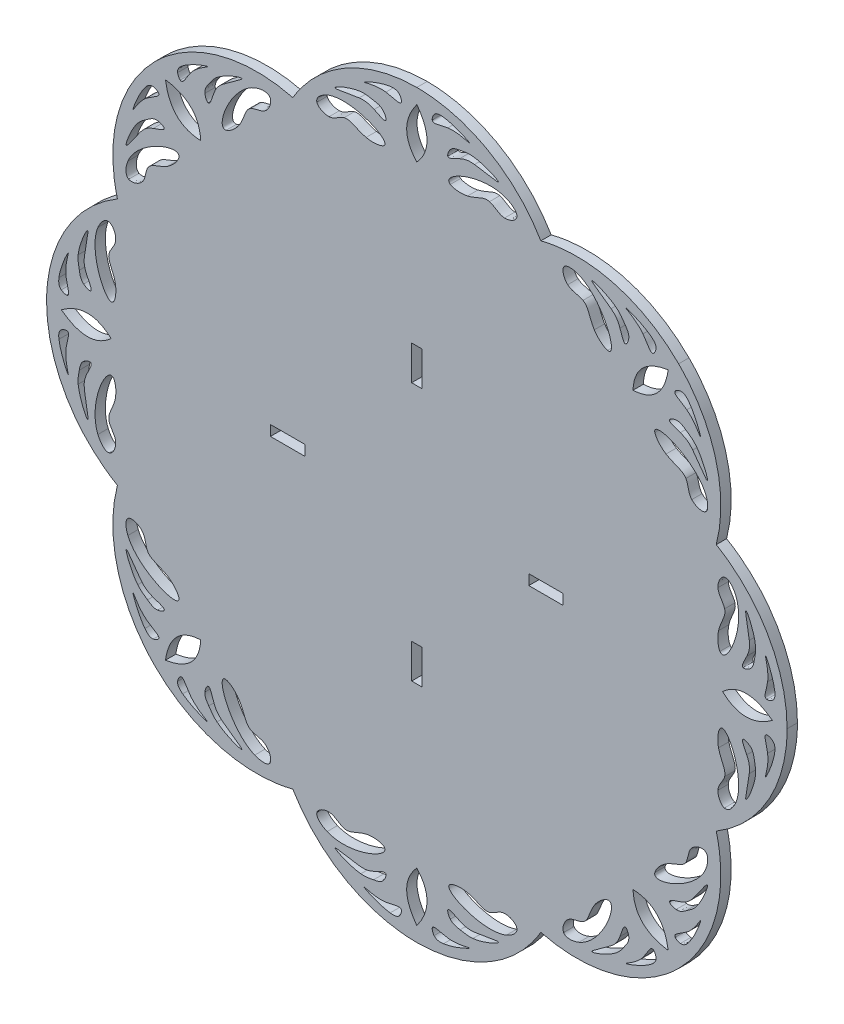
from build123d import *

# Parameters (mm, degrees)
MODEL_W                  = 2
MODEL_H                  = 6.6667
MODEL_W_2                = 6.6666
MODEL_H_2                = 2
RESSALTO_EXTRUS_O1_DEPTH = 2


with BuildPart() as part:
    # Model → Ressalto-extrusão1 (new body)
    with BuildSketch(Plane.XY):
        with BuildLine():
            add(Edge.make_bspline(
                [(57.9546, 38.6366), (66.4517, 43.6479), (71.6666, 52.7775), (71.6666, 62.6422)],
                knots=[0.055555556, 0.055555556, 0.055555556, 0.055555556, 0.111111111, 0.111111111, 0.111111111, 0.111111111], degree=3))
            add(Edge.make_bspline(
                [(71.6666, 62.6422), (71.6667, 72.5069), (66.4518, 81.6366), (57.9546, 86.6479)],
                knots=[0.111111111, 0.111111111, 0.111111111, 0.111111111, 0.166666667, 0.166666667, 0.166666667, 0.166666667], degree=3))
            add(Edge.make_bspline(
                [(57.9546, 86.6479), (60.4195, 96.1996), (57.6514, 106.3428), (50.676, 113.3182)],
                knots=[0.166666667, 0.166666667, 0.166666667, 0.166666667, 0.222222222, 0.222222222, 0.222222222, 0.222222222], degree=3))
            add(Edge.make_bspline(
                [(50.676, 113.3182), (43.7007, 120.2936), (33.5575, 123.0618), (24.0056, 120.5969)],
                knots=[0.222222222, 0.222222222, 0.222222222, 0.222222222, 0.277777778, 0.277777778, 0.277777778, 0.277777778], degree=3))
            add(Edge.make_bspline(
                [(24.0056, 120.5969), (18.9944, 129.094), (9.8647, 134.3089), (0, 134.3089)],
                knots=[0.277777778, 0.277777778, 0.277777778, 0.277777778, 0.333333333, 0.333333333, 0.333333333, 0.333333333], degree=3))
            add(Edge.make_bspline(
                [(0, 134.3089), (-9.8647, 134.3089), (-18.9944, 129.094), (-24.0056, 120.5969)],
                knots=[0.333333333, 0.333333333, 0.333333333, 0.333333333, 0.388888889, 0.388888889, 0.388888889, 0.388888889], degree=3))
            add(Edge.make_bspline(
                [(-24.0056, 120.5969), (-33.5574, 123.0618), (-43.7006, 120.2936), (-50.676, 113.3182)],
                knots=[0.388888889, 0.388888889, 0.388888889, 0.388888889, 0.444444444, 0.444444444, 0.444444444, 0.444444444], degree=3))
            add(Edge.make_bspline(
                [(-50.676, 113.3182), (-57.6514, 106.3428), (-60.4196, 96.1996), (-57.9546, 86.6479)],
                knots=[0.444444444, 0.444444444, 0.444444444, 0.444444444, 0.5, 0.5, 0.5, 0.5], degree=3))
            add(Edge.make_bspline(
                [(-57.9546, 86.6479), (-66.4517, 81.6367), (-71.6667, 72.507), (-71.6667, 62.6423)],
                knots=[0.5, 0.5, 0.5, 0.5, 0.555555556, 0.555555556, 0.555555556, 0.555555556], degree=3))
            add(Edge.make_bspline(
                [(-71.6667, 62.6423), (-71.6667, 52.7776), (-66.4517, 43.6479), (-57.9546, 38.6367)],
                knots=[0.555555556, 0.555555556, 0.555555556, 0.555555556, 0.611111111, 0.611111111, 0.611111111, 0.611111111], degree=3))
            add(Edge.make_bspline(
                [(-57.9546, 38.6367), (-60.4196, 29.0849), (-57.6514, 18.9417), (-50.676, 11.9663)],
                knots=[0.611111111, 0.611111111, 0.611111111, 0.611111111, 0.666666667, 0.666666667, 0.666666667, 0.666666667], degree=3))
            add(Edge.make_bspline(
                [(-50.676, 11.9663), (-43.7006, 4.9909), (-33.5574, 2.2227), (-24.0056, 4.6876)],
                knots=[0.666666667, 0.666666667, 0.666666667, 0.666666667, 0.722222222, 0.722222222, 0.722222222, 0.722222222], degree=3))
            add(Edge.make_bspline(
                [(-24.0056, 4.6876), (-18.9944, -3.8094), (-9.8647, -9.0244), (0, -9.0244)],
                knots=[0.722222222, 0.722222222, 0.722222222, 0.722222222, 0.777777778, 0.777777778, 0.777777778, 0.777777778], degree=3))
            add(Edge.make_bspline(
                [(0, -9.0244), (9.8647, -9.0244), (18.9944, -3.8094), (24.0056, 4.6876)],
                knots=[0.777777778, 0.777777778, 0.777777778, 0.777777778, 0.833333333, 0.833333333, 0.833333333, 0.833333333], degree=3))
            add(Edge.make_bspline(
                [(24.0056, 4.6876), (33.5574, 2.2227), (43.7005, 4.9909), (50.6759, 11.9663)],
                knots=[0.833333333, 0.833333333, 0.833333333, 0.833333333, 0.888888889, 0.888888889, 0.888888889, 0.888888889], degree=3))
            add(Edge.make_bspline(
                [(50.6759, 11.9663), (57.6513, 18.9416), (60.4195, 29.0848), (57.9546, 38.6366)],
                knots=[0.888888889, 0.888888889, 0.888888889, 0.888888889, 1, 1, 1, 1], degree=3))
        make_face()
        with Locations((0, 37.64225)):
            Rectangle(MODEL_W, MODEL_H, mode=Mode.SUBTRACT)
        with Locations((-25, 62.6423)):
            Rectangle(MODEL_W_2, MODEL_H_2, mode=Mode.SUBTRACT)
        with Locations((0, 87.64225)):
            Rectangle(MODEL_W, MODEL_H, mode=Mode.SUBTRACT)
        with Locations((25, 62.6423)):
            Rectangle(MODEL_W_2, MODEL_H_2, mode=Mode.SUBTRACT)
        with BuildLine():
            add(Edge.make_bspline(
                [(-52.251, 106.4004), (-51.0841, 107.3002), (-49.5495, 107.8231), (-50.0038, 108.419)],
                knots=[0, 0, 0, 0, 0.166666667, 0.166666667, 0.166666667, 0.166666667], degree=3))
            add(Edge.make_bspline(
                [(-50.0038, 108.419), (-50.1747, 108.6432), (-50.6272, 108.8778), (-51.0215, 108.9249)],
                knots=[0.166666667, 0.166666667, 0.166666667, 0.166666667, 0.333333333, 0.333333333, 0.333333333, 0.333333333], degree=3))
            add(Edge.make_bspline(
                [(-51.0215, 108.9249), (-51.675, 109.0029), (-52.169, 108.5658), (-52.6362, 107.9552)],
                knots=[0.333333333, 0.333333333, 0.333333333, 0.333333333, 0.5, 0.5, 0.5, 0.5], degree=3))
            add(Edge.make_bspline(
                [(-52.6362, 107.9552), (-53.9613, 106.2236), (-55.0715, 103.0965), (-54.9171, 103.125)],
                knots=[0.5, 0.5, 0.5, 0.5, 0.666666667, 0.666666667, 0.666666667, 0.666666667], degree=3))
            add(Edge.make_bspline(
                [(-54.9171, 103.125), (-54.795, 103.1474), (-53.8824, 105.1424), (-52.251, 106.4004)],
                knots=[0.666666667, 0.666666667, 0.666666667, 0.666666667, 1, 1, 1, 1], degree=3))
        make_face(mode=Mode.SUBTRACT)
        with BuildLine():
            add(Edge.make_bspline(
                [(-52.0754, 94.806), (-51.4239, 95.9147), (-49.6775, 96.0478), (-48.2286, 96.9769)],
                knots=[0, 0, 0, 0, 0.142857143, 0.142857143, 0.142857143, 0.142857143], degree=3))
            add(Edge.make_bspline(
                [(-48.2286, 96.9769), (-47.1297, 97.6816), (-46.2019, 98.8443), (-46.0577, 99.5288)],
                knots=[0.142857143, 0.142857143, 0.142857143, 0.142857143, 0.285714286, 0.285714286, 0.285714286, 0.285714286], degree=3))
            add(Edge.make_bspline(
                [(-46.0577, 99.5288), (-45.5709, 101.8383), (-54.0056, 98.7029), (-55.9222, 94.0062)],
                knots=[0.285714286, 0.285714286, 0.285714286, 0.285714286, 0.428571429, 0.428571429, 0.428571429, 0.428571429], degree=3))
            add(Edge.make_bspline(
                [(-55.9222, 94.0062), (-56.4255, 92.7729), (-56.4794, 91.4319), (-55.7669, 91.0417)],
                knots=[0.428571429, 0.428571429, 0.428571429, 0.428571429, 0.571428571, 0.571428571, 0.571428571, 0.571428571], degree=3))
            add(Edge.make_bspline(
                [(-55.7669, 91.0417), (-55.1261, 90.6907), (-53.8657, 91.1085), (-53.2181, 91.8352)],
                knots=[0.571428571, 0.571428571, 0.571428571, 0.571428571, 0.714285714, 0.714285714, 0.714285714, 0.714285714], degree=3))
            add(Edge.make_bspline(
                [(-53.2181, 91.8352), (-52.4459, 92.7016), (-52.5449, 94.007), (-52.0754, 94.806)],
                knots=[0.714285714, 0.714285714, 0.714285714, 0.714285714, 1, 1, 1, 1], degree=3))
        make_face(mode=Mode.SUBTRACT)
        with BuildLine():
            add(Edge.make_bspline(
                [(-32.1752, 114.7062), (-31.3763, 115.1757), (-30.0708, 115.0766), (-29.2044, 115.8488)],
                knots=[0, 0, 0, 0, 0.142857143, 0.142857143, 0.142857143, 0.142857143], degree=3))
            add(Edge.make_bspline(
                [(-29.2044, 115.8488), (-28.4777, 116.4964), (-28.0599, 117.757), (-28.4109, 118.3977)],
                knots=[0.142857143, 0.142857143, 0.142857143, 0.142857143, 0.285714286, 0.285714286, 0.285714286, 0.285714286], degree=3))
            add(Edge.make_bspline(
                [(-28.4109, 118.3977), (-28.8012, 119.1102), (-30.1421, 119.0563), (-31.3753, 118.553)],
                knots=[0.285714286, 0.285714286, 0.285714286, 0.285714286, 0.428571429, 0.428571429, 0.428571429, 0.428571429], degree=3))
            add(Edge.make_bspline(
                [(-31.3753, 118.553), (-36.0721, 116.6364), (-39.2076, 108.2017), (-36.898, 108.6885)],
                knots=[0.428571429, 0.428571429, 0.428571429, 0.428571429, 0.571428571, 0.571428571, 0.571428571, 0.571428571], degree=3))
            add(Edge.make_bspline(
                [(-36.898, 108.6885), (-36.2135, 108.8327), (-35.0509, 109.7605), (-34.3461, 110.8594)],
                knots=[0.571428571, 0.571428571, 0.571428571, 0.571428571, 0.714285714, 0.714285714, 0.714285714, 0.714285714], degree=3))
            add(Edge.make_bspline(
                [(-34.3461, 110.8594), (-33.417, 112.3083), (-33.2839, 114.0547), (-32.1752, 114.7062)],
                knots=[0.714285714, 0.714285714, 0.714285714, 0.714285714, 1, 1, 1, 1], degree=3))
        make_face(mode=Mode.SUBTRACT)
        with BuildLine():
            add(Edge.make_bspline(
                [(-43.7696, 114.8818), (-42.5116, 116.5132), (-40.5166, 117.4258), (-40.4942, 117.5479)],
                knots=[0, 0, 0, 0, 0.166666667, 0.166666667, 0.166666667, 0.166666667], degree=3))
            add(Edge.make_bspline(
                [(-40.4942, 117.5479), (-40.4657, 117.7023), (-43.5928, 116.5921), (-45.3244, 115.267)],
                knots=[0.166666667, 0.166666667, 0.166666667, 0.166666667, 0.333333333, 0.333333333, 0.333333333, 0.333333333], degree=3))
            add(Edge.make_bspline(
                [(-45.3244, 115.267), (-45.935, 114.7997), (-46.3721, 114.3058), (-46.2941, 113.6523)],
                knots=[0.333333333, 0.333333333, 0.333333333, 0.333333333, 0.5, 0.5, 0.5, 0.5], degree=3))
            add(Edge.make_bspline(
                [(-46.2941, 113.6523), (-46.247, 113.258), (-46.0124, 112.8056), (-45.7883, 112.6346)],
                knots=[0.5, 0.5, 0.5, 0.5, 0.666666667, 0.666666667, 0.666666667, 0.666666667], degree=3))
            add(Edge.make_bspline(
                [(-45.7883, 112.6346), (-45.1922, 112.1803), (-44.6694, 113.715), (-43.7696, 114.8818)],
                knots=[0.666666667, 0.666666667, 0.666666667, 0.666666667, 1, 1, 1, 1], degree=3))
        make_face(mode=Mode.SUBTRACT)
        with BuildLine():
            add(Edge.make_bspline(
                [(-65.3252, 54.2545), (-65.4688, 53.4561), (-65.6419, 52.7387), (-65.5496, 51.7858)],
                knots=[0, 0, 0, 0, 0.125, 0.125, 0.125, 0.125], degree=3))
            add(Edge.make_bspline(
                [(-65.5496, 51.7858), (-65.3525, 49.752), (-63.9461, 46.6455), (-63.6955, 46.8305)],
                knots=[0.125, 0.125, 0.125, 0.125, 0.25, 0.25, 0.25, 0.25], degree=3))
            add(Edge.make_bspline(
                [(-63.6955, 46.8305), (-63.4739, 46.9939), (-64.1556, 49.7294), (-64.3418, 51.4627)],
                knots=[0.25, 0.25, 0.25, 0.25, 0.375, 0.375, 0.375, 0.375], degree=3))
            add(Edge.make_bspline(
                [(-64.3418, 51.4627), (-64.4593, 52.5554), (-64.3798, 53.2498), (-63.8571, 54.3713)],
                knots=[0.375, 0.375, 0.375, 0.375, 0.5, 0.5, 0.5, 0.5], degree=3))
            add(Edge.make_bspline(
                [(-63.8571, 54.3713), (-63.4373, 55.272), (-62.7317, 56.4482), (-63.1569, 56.6336)],
                knots=[0.5, 0.5, 0.5, 0.5, 0.625, 0.625, 0.625, 0.625], degree=3))
            add(Edge.make_bspline(
                [(-63.1569, 56.6336), (-63.4116, 56.7446), (-64.0718, 56.5003), (-64.4916, 56.1539)],
                knots=[0.625, 0.625, 0.625, 0.625, 0.75, 0.75, 0.75, 0.75], degree=3))
            add(Edge.make_bspline(
                [(-64.4916, 56.1539), (-65.1055, 55.6473), (-65.205, 54.9225), (-65.3252, 54.2545)],
                knots=[0.75, 0.75, 0.75, 0.75, 1, 1, 1, 1], degree=3))
        make_face(mode=Mode.SUBTRACT)
        with BuildLine():
            add(Edge.make_bspline(
                [(-65.3252, 71.0071), (-65.205, 70.3391), (-65.1055, 69.6142), (-64.4916, 69.1077)],
                knots=[0, 0, 0, 0, 0.125, 0.125, 0.125, 0.125], degree=3))
            add(Edge.make_bspline(
                [(-64.4916, 69.1077), (-64.0718, 68.7613), (-63.4116, 68.517), (-63.1569, 68.628)],
                knots=[0.125, 0.125, 0.125, 0.125, 0.25, 0.25, 0.25, 0.25], degree=3))
            add(Edge.make_bspline(
                [(-63.1569, 68.628), (-62.7317, 68.8134), (-63.4373, 69.9896), (-63.8571, 70.8903)],
                knots=[0.25, 0.25, 0.25, 0.25, 0.375, 0.375, 0.375, 0.375], degree=3))
            add(Edge.make_bspline(
                [(-63.8571, 70.8903), (-64.3798, 72.0118), (-64.4593, 72.7061), (-64.3418, 73.7989)],
                knots=[0.375, 0.375, 0.375, 0.375, 0.5, 0.5, 0.5, 0.5], degree=3))
            add(Edge.make_bspline(
                [(-64.3418, 73.7989), (-64.1556, 75.5321), (-63.4739, 78.2676), (-63.6955, 78.4311)],
                knots=[0.5, 0.5, 0.5, 0.5, 0.625, 0.625, 0.625, 0.625], degree=3))
            add(Edge.make_bspline(
                [(-63.6955, 78.4311), (-63.9461, 78.616), (-65.3525, 75.5095), (-65.5496, 73.4757)],
                knots=[0.625, 0.625, 0.625, 0.625, 0.75, 0.75, 0.75, 0.75], degree=3))
            add(Edge.make_bspline(
                [(-65.5496, 73.4757), (-65.6419, 72.5229), (-65.4688, 71.8054), (-65.3252, 71.0071)],
                knots=[0.75, 0.75, 0.75, 0.75, 1, 1, 1, 1], degree=3))
        make_face(mode=Mode.SUBTRACT)
        with BuildLine():
            add(Edge.make_bspline(
                [(-43.7696, 10.3798), (-44.6694, 11.5466), (-45.1922, 13.0812), (-45.7883, 12.6269)],
                knots=[0, 0, 0, 0, 0.166666667, 0.166666667, 0.166666667, 0.166666667], degree=3))
            add(Edge.make_bspline(
                [(-45.7883, 12.6269), (-46.0124, 12.456), (-46.247, 12.0036), (-46.2941, 11.6093)],
                knots=[0.166666667, 0.166666667, 0.166666667, 0.166666667, 0.333333333, 0.333333333, 0.333333333, 0.333333333], degree=3))
            add(Edge.make_bspline(
                [(-46.2941, 11.6093), (-46.3721, 10.9558), (-45.935, 10.4618), (-45.3244, 9.9946)],
                knots=[0.333333333, 0.333333333, 0.333333333, 0.333333333, 0.5, 0.5, 0.5, 0.5], degree=3))
            add(Edge.make_bspline(
                [(-45.3244, 9.9946), (-43.5928, 8.6695), (-40.4657, 7.5593), (-40.4942, 7.7137)],
                knots=[0.5, 0.5, 0.5, 0.5, 0.666666667, 0.666666667, 0.666666667, 0.666666667], degree=3))
            add(Edge.make_bspline(
                [(-40.4942, 7.7137), (-40.5166, 7.8358), (-42.5116, 8.7484), (-43.7696, 10.3798)],
                knots=[0.666666667, 0.666666667, 0.666666667, 0.666666667, 1, 1, 1, 1], degree=3))
        make_face(mode=Mode.SUBTRACT)
        with BuildLine():
            add(Edge.make_bspline(
                [(-32.1752, 10.5553), (-33.2839, 11.2069), (-33.417, 12.9533), (-34.3461, 14.4022)],
                knots=[0, 0, 0, 0, 0.142857143, 0.142857143, 0.142857143, 0.142857143], degree=3))
            add(Edge.make_bspline(
                [(-34.3461, 14.4022), (-35.0509, 15.5011), (-36.2135, 16.4289), (-36.898, 16.5731)],
                knots=[0.142857143, 0.142857143, 0.142857143, 0.142857143, 0.285714286, 0.285714286, 0.285714286, 0.285714286], degree=3))
            add(Edge.make_bspline(
                [(-36.898, 16.5731), (-39.2076, 17.0598), (-36.0721, 8.6252), (-31.3753, 6.7085)],
                knots=[0.285714286, 0.285714286, 0.285714286, 0.285714286, 0.428571429, 0.428571429, 0.428571429, 0.428571429], degree=3))
            add(Edge.make_bspline(
                [(-31.3753, 6.7085), (-30.1421, 6.2053), (-28.8012, 6.1514), (-28.4109, 6.8639)],
                knots=[0.428571429, 0.428571429, 0.428571429, 0.428571429, 0.571428571, 0.571428571, 0.571428571, 0.571428571], degree=3))
            add(Edge.make_bspline(
                [(-28.4109, 6.8639), (-28.0599, 7.5046), (-28.4777, 8.7651), (-29.2044, 9.4128)],
                knots=[0.571428571, 0.571428571, 0.571428571, 0.571428571, 0.714285714, 0.714285714, 0.714285714, 0.714285714], degree=3))
            add(Edge.make_bspline(
                [(-29.2044, 9.4128), (-30.0708, 10.185), (-31.3763, 10.0859), (-32.1752, 10.5553)],
                knots=[0.714285714, 0.714285714, 0.714285714, 0.714285714, 1, 1, 1, 1], degree=3))
        make_face(mode=Mode.SUBTRACT)
        with BuildLine():
            add(Edge.make_bspline(
                [(-52.0754, 30.4556), (-52.5449, 31.2546), (-52.4459, 32.56), (-53.2181, 33.4264)],
                knots=[0, 0, 0, 0, 0.142857143, 0.142857143, 0.142857143, 0.142857143], degree=3))
            add(Edge.make_bspline(
                [(-53.2181, 33.4264), (-53.8657, 34.1531), (-55.1261, 34.5708), (-55.7669, 34.2199)],
                knots=[0.142857143, 0.142857143, 0.142857143, 0.142857143, 0.285714286, 0.285714286, 0.285714286, 0.285714286], degree=3))
            add(Edge.make_bspline(
                [(-55.7669, 34.2199), (-56.4794, 33.8296), (-56.4255, 32.4887), (-55.9222, 31.2554)],
                knots=[0.285714286, 0.285714286, 0.285714286, 0.285714286, 0.428571429, 0.428571429, 0.428571429, 0.428571429], degree=3))
            add(Edge.make_bspline(
                [(-55.9222, 31.2554), (-54.0056, 26.5587), (-45.5709, 23.4233), (-46.0577, 25.7328)],
                knots=[0.428571429, 0.428571429, 0.428571429, 0.428571429, 0.571428571, 0.571428571, 0.571428571, 0.571428571], degree=3))
            add(Edge.make_bspline(
                [(-46.0577, 25.7328), (-46.2019, 26.4173), (-47.1297, 27.5799), (-48.2286, 28.2847)],
                knots=[0.571428571, 0.571428571, 0.571428571, 0.571428571, 0.714285714, 0.714285714, 0.714285714, 0.714285714], degree=3))
            add(Edge.make_bspline(
                [(-48.2286, 28.2847), (-49.6775, 29.2138), (-51.4239, 29.3469), (-52.0754, 30.4556)],
                knots=[0.714285714, 0.714285714, 0.714285714, 0.714285714, 1, 1, 1, 1], degree=3))
        make_face(mode=Mode.SUBTRACT)
        with BuildLine():
            add(Edge.make_bspline(
                [(-52.251, 18.8612), (-53.8824, 20.1192), (-54.795, 22.1142), (-54.9171, 22.1366)],
                knots=[0, 0, 0, 0, 0.166666667, 0.166666667, 0.166666667, 0.166666667], degree=3))
            add(Edge.make_bspline(
                [(-54.9171, 22.1366), (-55.0715, 22.1651), (-53.9613, 19.038), (-52.6362, 17.3064)],
                knots=[0.166666667, 0.166666667, 0.166666667, 0.166666667, 0.333333333, 0.333333333, 0.333333333, 0.333333333], degree=3))
            add(Edge.make_bspline(
                [(-52.6362, 17.3064), (-52.169, 16.6958), (-51.675, 16.2587), (-51.0215, 16.3367)],
                knots=[0.333333333, 0.333333333, 0.333333333, 0.333333333, 0.5, 0.5, 0.5, 0.5], degree=3))
            add(Edge.make_bspline(
                [(-51.0215, 16.3367), (-50.6272, 16.3838), (-50.1747, 16.6183), (-50.0038, 16.8425)],
                knots=[0.5, 0.5, 0.5, 0.5, 0.666666667, 0.666666667, 0.666666667, 0.666666667], degree=3))
            add(Edge.make_bspline(
                [(-50.0038, 16.8425), (-49.5495, 17.4385), (-51.0841, 17.9613), (-52.251, 18.8612)],
                knots=[0.666666667, 0.666666667, 0.666666667, 0.666666667, 1, 1, 1, 1], degree=3))
        make_face(mode=Mode.SUBTRACT)
        with BuildLine():
            add(Edge.make_bspline(
                [(8.3763, -2.6943), (9.1746, -2.838), (9.8921, -3.0111), (10.8449, -2.9188)],
                knots=[0, 0, 0, 0, 0.125, 0.125, 0.125, 0.125], degree=3))
            add(Edge.make_bspline(
                [(10.8449, -2.9188), (12.8788, -2.7217), (15.9852, -1.3154), (15.8003, -1.0647)],
                knots=[0.125, 0.125, 0.125, 0.125, 0.25, 0.25, 0.25, 0.25], degree=3))
            add(Edge.make_bspline(
                [(15.8003, -1.0647), (15.6369, -0.8432), (12.9013, -1.5248), (11.1681, -1.711)],
                knots=[0.25, 0.25, 0.25, 0.25, 0.375, 0.375, 0.375, 0.375], degree=3))
            add(Edge.make_bspline(
                [(11.1681, -1.711), (10.0754, -1.8285), (9.381, -1.749), (8.2594, -1.2263)],
                knots=[0.375, 0.375, 0.375, 0.375, 0.5, 0.5, 0.5, 0.5], degree=3))
            add(Edge.make_bspline(
                [(8.2594, -1.2263), (7.3588, -0.8065), (6.1826, -0.1009), (5.9972, -0.5261)],
                knots=[0.5, 0.5, 0.5, 0.5, 0.625, 0.625, 0.625, 0.625], degree=3))
            add(Edge.make_bspline(
                [(5.9972, -0.5261), (5.8862, -0.7807), (6.1305, -1.441), (6.4769, -1.8608)],
                knots=[0.625, 0.625, 0.625, 0.625, 0.75, 0.75, 0.75, 0.75], degree=3))
            add(Edge.make_bspline(
                [(6.4769, -1.8608), (6.9834, -2.4747), (7.7082, -2.5742), (8.3763, -2.6943)],
                knots=[0.75, 0.75, 0.75, 0.75, 1, 1, 1, 1], degree=3))
        make_face(mode=Mode.SUBTRACT)
        with BuildLine():
            add(Edge.make_bspline(
                [(-8.3763, -2.6943), (-7.7083, -2.5742), (-6.9834, -2.4747), (-6.4769, -1.8608)],
                knots=[0, 0, 0, 0, 0.125, 0.125, 0.125, 0.125], degree=3))
            add(Edge.make_bspline(
                [(-6.4769, -1.8608), (-6.1305, -1.441), (-5.8862, -0.7807), (-5.9972, -0.5261)],
                knots=[0.125, 0.125, 0.125, 0.125, 0.25, 0.25, 0.25, 0.25], degree=3))
            add(Edge.make_bspline(
                [(-5.9972, -0.5261), (-6.1826, -0.1009), (-7.3588, -0.8065), (-8.2595, -1.2263)],
                knots=[0.25, 0.25, 0.25, 0.25, 0.375, 0.375, 0.375, 0.375], degree=3))
            add(Edge.make_bspline(
                [(-8.2595, -1.2263), (-9.381, -1.749), (-10.0754, -1.8285), (-11.1681, -1.711)],
                knots=[0.375, 0.375, 0.375, 0.375, 0.5, 0.5, 0.5, 0.5], degree=3))
            add(Edge.make_bspline(
                [(-11.1681, -1.711), (-12.9013, -1.5248), (-15.6369, -0.8432), (-15.8004, -1.0647)],
                knots=[0.5, 0.5, 0.5, 0.5, 0.625, 0.625, 0.625, 0.625], degree=3))
            add(Edge.make_bspline(
                [(-15.8004, -1.0647), (-15.9853, -1.3154), (-12.8788, -2.7217), (-10.845, -2.9188)],
                knots=[0.625, 0.625, 0.625, 0.625, 0.75, 0.75, 0.75, 0.75], degree=3))
            add(Edge.make_bspline(
                [(-10.845, -2.9188), (-9.8921, -3.0111), (-9.1746, -2.838), (-8.3763, -2.6943)],
                knots=[0.75, 0.75, 0.75, 0.75, 1, 1, 1, 1], degree=3))
        make_face(mode=Mode.SUBTRACT)
        with BuildLine():
            add(Edge.make_bspline(
                [(52.251, 18.8612), (51.0842, 17.9613), (49.5495, 17.4385), (50.0038, 16.8425)],
                knots=[0, 0, 0, 0, 0.166666667, 0.166666667, 0.166666667, 0.166666667], degree=3))
            add(Edge.make_bspline(
                [(50.0038, 16.8425), (50.1747, 16.6183), (50.6272, 16.3838), (51.0215, 16.3367)],
                knots=[0.166666667, 0.166666667, 0.166666667, 0.166666667, 0.333333333, 0.333333333, 0.333333333, 0.333333333], degree=3))
            add(Edge.make_bspline(
                [(51.0215, 16.3367), (51.675, 16.2587), (52.169, 16.6958), (52.6362, 17.3064)],
                knots=[0.333333333, 0.333333333, 0.333333333, 0.333333333, 0.5, 0.5, 0.5, 0.5], degree=3))
            add(Edge.make_bspline(
                [(52.6362, 17.3064), (53.9612, 19.038), (55.0715, 22.1651), (54.9171, 22.1366)],
                knots=[0.5, 0.5, 0.5, 0.5, 0.666666667, 0.666666667, 0.666666667, 0.666666667], degree=3))
            add(Edge.make_bspline(
                [(54.9171, 22.1366), (54.795, 22.1142), (53.8824, 20.1192), (52.251, 18.8612)],
                knots=[0.666666667, 0.666666667, 0.666666667, 0.666666667, 1, 1, 1, 1], degree=3))
        make_face(mode=Mode.SUBTRACT)
        with BuildLine():
            add(Edge.make_bspline(
                [(52.0754, 30.4556), (51.4239, 29.3469), (49.6775, 29.2138), (48.2286, 28.2847)],
                knots=[0, 0, 0, 0, 0.142857143, 0.142857143, 0.142857143, 0.142857143], degree=3))
            add(Edge.make_bspline(
                [(48.2286, 28.2847), (47.1297, 27.5799), (46.2019, 26.4173), (46.0577, 25.7328)],
                knots=[0.142857143, 0.142857143, 0.142857143, 0.142857143, 0.285714286, 0.285714286, 0.285714286, 0.285714286], degree=3))
            add(Edge.make_bspline(
                [(46.0577, 25.7328), (45.5709, 23.4233), (54.0056, 26.5587), (55.9222, 31.2554)],
                knots=[0.285714286, 0.285714286, 0.285714286, 0.285714286, 0.428571429, 0.428571429, 0.428571429, 0.428571429], degree=3))
            add(Edge.make_bspline(
                [(55.9222, 31.2554), (56.4255, 32.4887), (56.4794, 33.8296), (55.7669, 34.2199)],
                knots=[0.428571429, 0.428571429, 0.428571429, 0.428571429, 0.571428571, 0.571428571, 0.571428571, 0.571428571], degree=3))
            add(Edge.make_bspline(
                [(55.7669, 34.2199), (55.1262, 34.5708), (53.8657, 34.1531), (53.218, 33.4264)],
                knots=[0.571428571, 0.571428571, 0.571428571, 0.571428571, 0.714285714, 0.714285714, 0.714285714, 0.714285714], degree=3))
            add(Edge.make_bspline(
                [(53.218, 33.4264), (52.4458, 32.56), (52.5449, 31.2546), (52.0754, 30.4556)],
                knots=[0.714285714, 0.714285714, 0.714285714, 0.714285714, 1, 1, 1, 1], degree=3))
        make_face(mode=Mode.SUBTRACT)
        with BuildLine():
            add(Edge.make_bspline(
                [(32.1751, 10.5553), (31.3762, 10.0859), (30.0708, 10.185), (29.2043, 9.4128)],
                knots=[0, 0, 0, 0, 0.142857143, 0.142857143, 0.142857143, 0.142857143], degree=3))
            add(Edge.make_bspline(
                [(29.2043, 9.4128), (28.4777, 8.7651), (28.0599, 7.5046), (28.4109, 6.8639)],
                knots=[0.142857143, 0.142857143, 0.142857143, 0.142857143, 0.285714286, 0.285714286, 0.285714286, 0.285714286], degree=3))
            add(Edge.make_bspline(
                [(28.4109, 6.8639), (28.8012, 6.1514), (30.1421, 6.2053), (31.3753, 6.7085)],
                knots=[0.285714286, 0.285714286, 0.285714286, 0.285714286, 0.428571429, 0.428571429, 0.428571429, 0.428571429], degree=3))
            add(Edge.make_bspline(
                [(31.3753, 6.7085), (36.0721, 8.6252), (39.2075, 17.0598), (36.8979, 16.5731)],
                knots=[0.428571429, 0.428571429, 0.428571429, 0.428571429, 0.571428571, 0.571428571, 0.571428571, 0.571428571], degree=3))
            add(Edge.make_bspline(
                [(36.8979, 16.5731), (36.2135, 16.4289), (35.0509, 15.5011), (34.3461, 14.4022)],
                knots=[0.571428571, 0.571428571, 0.571428571, 0.571428571, 0.714285714, 0.714285714, 0.714285714, 0.714285714], degree=3))
            add(Edge.make_bspline(
                [(34.3461, 14.4022), (33.417, 12.9533), (33.2838, 11.2069), (32.1751, 10.5553)],
                knots=[0.714285714, 0.714285714, 0.714285714, 0.714285714, 1, 1, 1, 1], degree=3))
        make_face(mode=Mode.SUBTRACT)
        with BuildLine():
            add(Edge.make_bspline(
                [(43.7696, 10.3798), (42.5116, 8.7484), (40.5166, 7.8358), (40.4941, 7.7137)],
                knots=[0, 0, 0, 0, 0.166666667, 0.166666667, 0.166666667, 0.166666667], degree=3))
            add(Edge.make_bspline(
                [(40.4941, 7.7137), (40.4657, 7.5593), (43.5927, 8.6695), (45.3244, 9.9946)],
                knots=[0.166666667, 0.166666667, 0.166666667, 0.166666667, 0.333333333, 0.333333333, 0.333333333, 0.333333333], degree=3))
            add(Edge.make_bspline(
                [(45.3244, 9.9946), (45.9349, 10.4618), (46.3721, 10.9558), (46.2941, 11.6093)],
                knots=[0.333333333, 0.333333333, 0.333333333, 0.333333333, 0.5, 0.5, 0.5, 0.5], degree=3))
            add(Edge.make_bspline(
                [(46.2941, 11.6093), (46.247, 12.0036), (46.0124, 12.456), (45.7882, 12.6269)],
                knots=[0.5, 0.5, 0.5, 0.5, 0.666666667, 0.666666667, 0.666666667, 0.666666667], degree=3))
            add(Edge.make_bspline(
                [(45.7882, 12.6269), (45.1922, 13.0812), (44.6694, 11.5466), (43.7696, 10.3798)],
                knots=[0.666666667, 0.666666667, 0.666666667, 0.666666667, 1, 1, 1, 1], degree=3))
        make_face(mode=Mode.SUBTRACT)
        with BuildLine():
            add(Edge.make_bspline(
                [(65.3252, 71.0071), (65.4688, 71.8054), (65.6419, 72.5229), (65.5496, 73.4757)],
                knots=[0, 0, 0, 0, 0.125, 0.125, 0.125, 0.125], degree=3))
            add(Edge.make_bspline(
                [(65.5496, 73.4757), (65.3525, 75.5095), (63.9461, 78.616), (63.6955, 78.4311)],
                knots=[0.125, 0.125, 0.125, 0.125, 0.25, 0.25, 0.25, 0.25], degree=3))
            add(Edge.make_bspline(
                [(63.6955, 78.4311), (63.4739, 78.2676), (64.1556, 75.5321), (64.3418, 73.7989)],
                knots=[0.25, 0.25, 0.25, 0.25, 0.375, 0.375, 0.375, 0.375], degree=3))
            add(Edge.make_bspline(
                [(64.3418, 73.7989), (64.4593, 72.7061), (64.3798, 72.0118), (63.8571, 70.8903)],
                knots=[0.375, 0.375, 0.375, 0.375, 0.5, 0.5, 0.5, 0.5], degree=3))
            add(Edge.make_bspline(
                [(63.8571, 70.8903), (63.4373, 69.9896), (62.7316, 68.8134), (63.1568, 68.628)],
                knots=[0.5, 0.5, 0.5, 0.5, 0.625, 0.625, 0.625, 0.625], degree=3))
            add(Edge.make_bspline(
                [(63.1568, 68.628), (63.4115, 68.517), (64.0718, 68.7613), (64.4916, 69.1077)],
                knots=[0.625, 0.625, 0.625, 0.625, 0.75, 0.75, 0.75, 0.75], degree=3))
            add(Edge.make_bspline(
                [(64.4916, 69.1077), (65.1055, 69.6142), (65.205, 70.3391), (65.3252, 71.0071)],
                knots=[0.75, 0.75, 0.75, 0.75, 1, 1, 1, 1], degree=3))
        make_face(mode=Mode.SUBTRACT)
        with BuildLine():
            add(Edge.make_bspline(
                [(65.3252, 54.2545), (65.205, 54.9225), (65.1055, 55.6473), (64.4916, 56.1539)],
                knots=[0, 0, 0, 0, 0.125, 0.125, 0.125, 0.125], degree=3))
            add(Edge.make_bspline(
                [(64.4916, 56.1539), (64.0718, 56.5003), (63.4115, 56.7446), (63.1568, 56.6336)],
                knots=[0.125, 0.125, 0.125, 0.125, 0.25, 0.25, 0.25, 0.25], degree=3))
            add(Edge.make_bspline(
                [(63.1568, 56.6336), (62.7316, 56.4482), (63.4373, 55.272), (63.8571, 54.3713)],
                knots=[0.25, 0.25, 0.25, 0.25, 0.375, 0.375, 0.375, 0.375], degree=3))
            add(Edge.make_bspline(
                [(63.8571, 54.3713), (64.3798, 53.2498), (64.4593, 52.5554), (64.3418, 51.4627)],
                knots=[0.375, 0.375, 0.375, 0.375, 0.5, 0.5, 0.5, 0.5], degree=3))
            add(Edge.make_bspline(
                [(64.3418, 51.4627), (64.1556, 49.7294), (63.4739, 46.9939), (63.6955, 46.8305)],
                knots=[0.5, 0.5, 0.5, 0.5, 0.625, 0.625, 0.625, 0.625], degree=3))
            add(Edge.make_bspline(
                [(63.6955, 46.8305), (63.9461, 46.6455), (65.3525, 49.752), (65.5496, 51.7858)],
                knots=[0.625, 0.625, 0.625, 0.625, 0.75, 0.75, 0.75, 0.75], degree=3))
            add(Edge.make_bspline(
                [(65.5496, 51.7858), (65.6419, 52.7387), (65.4688, 53.4561), (65.3252, 54.2545)],
                knots=[0.75, 0.75, 0.75, 0.75, 1, 1, 1, 1], degree=3))
        make_face(mode=Mode.SUBTRACT)
        with BuildLine():
            add(Edge.make_bspline(
                [(43.7696, 114.8818), (44.6694, 113.715), (45.1922, 112.1803), (45.7882, 112.6346)],
                knots=[0, 0, 0, 0, 0.166666667, 0.166666667, 0.166666667, 0.166666667], degree=3))
            add(Edge.make_bspline(
                [(45.7882, 112.6346), (46.0124, 112.8056), (46.247, 113.258), (46.2941, 113.6523)],
                knots=[0.166666667, 0.166666667, 0.166666667, 0.166666667, 0.333333333, 0.333333333, 0.333333333, 0.333333333], degree=3))
            add(Edge.make_bspline(
                [(46.2941, 113.6523), (46.3721, 114.3058), (45.9349, 114.7997), (45.3244, 115.267)],
                knots=[0.333333333, 0.333333333, 0.333333333, 0.333333333, 0.5, 0.5, 0.5, 0.5], degree=3))
            add(Edge.make_bspline(
                [(45.3244, 115.267), (43.5927, 116.5921), (40.4657, 117.7023), (40.4941, 117.5479)],
                knots=[0.5, 0.5, 0.5, 0.5, 0.666666667, 0.666666667, 0.666666667, 0.666666667], degree=3))
            add(Edge.make_bspline(
                [(40.4941, 117.5479), (40.5166, 117.4258), (42.5116, 116.5132), (43.7696, 114.8818)],
                knots=[0.666666667, 0.666666667, 0.666666667, 0.666666667, 1, 1, 1, 1], degree=3))
        make_face(mode=Mode.SUBTRACT)
        with BuildLine():
            add(Edge.make_bspline(
                [(32.1751, 114.7062), (33.2838, 114.0547), (33.417, 112.3083), (34.3461, 110.8594)],
                knots=[0, 0, 0, 0, 0.142857143, 0.142857143, 0.142857143, 0.142857143], degree=3))
            add(Edge.make_bspline(
                [(34.3461, 110.8594), (35.0509, 109.7605), (36.2135, 108.8327), (36.8979, 108.6885)],
                knots=[0.142857143, 0.142857143, 0.142857143, 0.142857143, 0.285714286, 0.285714286, 0.285714286, 0.285714286], degree=3))
            add(Edge.make_bspline(
                [(36.8979, 108.6885), (39.2075, 108.2017), (36.0721, 116.6364), (31.3753, 118.553)],
                knots=[0.285714286, 0.285714286, 0.285714286, 0.285714286, 0.428571429, 0.428571429, 0.428571429, 0.428571429], degree=3))
            add(Edge.make_bspline(
                [(31.3753, 118.553), (30.1421, 119.0563), (28.8012, 119.1102), (28.4109, 118.3977)],
                knots=[0.428571429, 0.428571429, 0.428571429, 0.428571429, 0.571428571, 0.571428571, 0.571428571, 0.571428571], degree=3))
            add(Edge.make_bspline(
                [(28.4109, 118.3977), (28.0599, 117.757), (28.4777, 116.4964), (29.2043, 115.8488)],
                knots=[0.571428571, 0.571428571, 0.571428571, 0.571428571, 0.714285714, 0.714285714, 0.714285714, 0.714285714], degree=3))
            add(Edge.make_bspline(
                [(29.2043, 115.8488), (30.0708, 115.0766), (31.3762, 115.1757), (32.1751, 114.7062)],
                knots=[0.714285714, 0.714285714, 0.714285714, 0.714285714, 1, 1, 1, 1], degree=3))
        make_face(mode=Mode.SUBTRACT)
        with BuildLine():
            add(Edge.make_bspline(
                [(52.0754, 94.806), (52.5449, 94.007), (52.4458, 92.7016), (53.218, 91.8352)],
                knots=[0, 0, 0, 0, 0.142857143, 0.142857143, 0.142857143, 0.142857143], degree=3))
            add(Edge.make_bspline(
                [(53.218, 91.8352), (53.8657, 91.1085), (55.1262, 90.6907), (55.7669, 91.0417)],
                knots=[0.142857143, 0.142857143, 0.142857143, 0.142857143, 0.285714286, 0.285714286, 0.285714286, 0.285714286], degree=3))
            add(Edge.make_bspline(
                [(55.7669, 91.0417), (56.4794, 91.4319), (56.4255, 92.7729), (55.9222, 94.0062)],
                knots=[0.285714286, 0.285714286, 0.285714286, 0.285714286, 0.428571429, 0.428571429, 0.428571429, 0.428571429], degree=3))
            add(Edge.make_bspline(
                [(55.9222, 94.0062), (54.0056, 98.7029), (45.5709, 101.8383), (46.0577, 99.5288)],
                knots=[0.428571429, 0.428571429, 0.428571429, 0.428571429, 0.571428571, 0.571428571, 0.571428571, 0.571428571], degree=3))
            add(Edge.make_bspline(
                [(46.0577, 99.5288), (46.2019, 98.8443), (47.1297, 97.6816), (48.2286, 96.9769)],
                knots=[0.571428571, 0.571428571, 0.571428571, 0.571428571, 0.714285714, 0.714285714, 0.714285714, 0.714285714], degree=3))
            add(Edge.make_bspline(
                [(48.2286, 96.9769), (49.6775, 96.0478), (51.4239, 95.9147), (52.0754, 94.806)],
                knots=[0.714285714, 0.714285714, 0.714285714, 0.714285714, 1, 1, 1, 1], degree=3))
        make_face(mode=Mode.SUBTRACT)
        with BuildLine():
            add(Edge.make_bspline(
                [(52.251, 106.4004), (53.8824, 105.1424), (54.795, 103.1474), (54.9171, 103.125)],
                knots=[0, 0, 0, 0, 0.166666667, 0.166666667, 0.166666667, 0.166666667], degree=3))
            add(Edge.make_bspline(
                [(54.9171, 103.125), (55.0715, 103.0965), (53.9612, 106.2236), (52.6362, 107.9552)],
                knots=[0.166666667, 0.166666667, 0.166666667, 0.166666667, 0.333333333, 0.333333333, 0.333333333, 0.333333333], degree=3))
            add(Edge.make_bspline(
                [(52.6362, 107.9552), (52.169, 108.5658), (51.675, 109.0029), (51.0215, 108.9249)],
                knots=[0.333333333, 0.333333333, 0.333333333, 0.333333333, 0.5, 0.5, 0.5, 0.5], degree=3))
            add(Edge.make_bspline(
                [(51.0215, 108.9249), (50.6272, 108.8778), (50.1747, 108.6432), (50.0038, 108.419)],
                knots=[0.5, 0.5, 0.5, 0.5, 0.666666667, 0.666666667, 0.666666667, 0.666666667], degree=3))
            add(Edge.make_bspline(
                [(50.0038, 108.419), (49.5495, 107.8231), (51.0842, 107.3002), (52.251, 106.4004)],
                knots=[0.666666667, 0.666666667, 0.666666667, 0.666666667, 1, 1, 1, 1], degree=3))
        make_face(mode=Mode.SUBTRACT)
        with BuildLine():
            add(Edge.make_bspline(
                [(-8.3763, 127.9559), (-9.1746, 128.0996), (-9.8921, 128.2727), (-10.845, 128.1804)],
                knots=[0, 0, 0, 0, 0.125, 0.125, 0.125, 0.125], degree=3))
            add(Edge.make_bspline(
                [(-10.845, 128.1804), (-12.8788, 127.9833), (-15.9853, 126.5769), (-15.8004, 126.3263)],
                knots=[0.125, 0.125, 0.125, 0.125, 0.25, 0.25, 0.25, 0.25], degree=3))
            add(Edge.make_bspline(
                [(-15.8004, 126.3263), (-15.6369, 126.1047), (-12.9013, 126.7864), (-11.1681, 126.9726)],
                knots=[0.25, 0.25, 0.25, 0.25, 0.375, 0.375, 0.375, 0.375], degree=3))
            add(Edge.make_bspline(
                [(-11.1681, 126.9726), (-10.0754, 127.0901), (-9.381, 127.0106), (-8.2595, 126.4879)],
                knots=[0.375, 0.375, 0.375, 0.375, 0.5, 0.5, 0.5, 0.5], degree=3))
            add(Edge.make_bspline(
                [(-8.2595, 126.4879), (-7.3588, 126.0681), (-6.1826, 125.3625), (-5.9972, 125.7876)],
                knots=[0.5, 0.5, 0.5, 0.5, 0.625, 0.625, 0.625, 0.625], degree=3))
            add(Edge.make_bspline(
                [(-5.9972, 125.7876), (-5.8862, 126.0423), (-6.1305, 126.7026), (-6.4769, 127.1224)],
                knots=[0.625, 0.625, 0.625, 0.625, 0.75, 0.75, 0.75, 0.75], degree=3))
            add(Edge.make_bspline(
                [(-6.4769, 127.1224), (-6.9834, 127.7363), (-7.7083, 127.8358), (-8.3763, 127.9559)],
                knots=[0.75, 0.75, 0.75, 0.75, 1, 1, 1, 1], degree=3))
        make_face(mode=Mode.SUBTRACT)
        with BuildLine():
            add(Edge.make_bspline(
                [(8.3763, 127.9559), (7.7082, 127.8358), (6.9834, 127.7363), (6.4769, 127.1224)],
                knots=[0, 0, 0, 0, 0.125, 0.125, 0.125, 0.125], degree=3))
            add(Edge.make_bspline(
                [(6.4769, 127.1224), (6.1305, 126.7026), (5.8862, 126.0423), (5.9972, 125.7876)],
                knots=[0.125, 0.125, 0.125, 0.125, 0.25, 0.25, 0.25, 0.25], degree=3))
            add(Edge.make_bspline(
                [(5.9972, 125.7876), (6.1826, 125.3625), (7.3588, 126.0681), (8.2594, 126.4879)],
                knots=[0.25, 0.25, 0.25, 0.25, 0.375, 0.375, 0.375, 0.375], degree=3))
            add(Edge.make_bspline(
                [(8.2594, 126.4879), (9.381, 127.0106), (10.0754, 127.0901), (11.1681, 126.9726)],
                knots=[0.375, 0.375, 0.375, 0.375, 0.5, 0.5, 0.5, 0.5], degree=3))
            add(Edge.make_bspline(
                [(11.1681, 126.9726), (12.9013, 126.7864), (15.6369, 126.1047), (15.8003, 126.3263)],
                knots=[0.5, 0.5, 0.5, 0.5, 0.625, 0.625, 0.625, 0.625], degree=3))
            add(Edge.make_bspline(
                [(15.8003, 126.3263), (15.9852, 126.5769), (12.8788, 127.9833), (10.8449, 128.1804)],
                knots=[0.625, 0.625, 0.625, 0.625, 0.75, 0.75, 0.75, 0.75], degree=3))
            add(Edge.make_bspline(
                [(10.8449, 128.1804), (9.8921, 128.2727), (9.1746, 128.0996), (8.3763, 127.9559)],
                knots=[0.75, 0.75, 0.75, 0.75, 1, 1, 1, 1], degree=3))
        make_face(mode=Mode.SUBTRACT)
        with BuildLine():
            add(Edge.make_bspline(
                [(5.9972, 130.5276), (8.0404, 130.7916), (10.0963, 130.0262), (10.1985, 130.0967)],
                knots=[0, 0, 0, 0, 0.166666667, 0.166666667, 0.166666667, 0.166666667], degree=3))
            add(Edge.make_bspline(
                [(10.1985, 130.0967), (10.3278, 130.1858), (7.3317, 131.6119), (5.1702, 131.8994)],
                knots=[0.166666667, 0.166666667, 0.166666667, 0.166666667, 0.333333333, 0.333333333, 0.333333333, 0.333333333], degree=3))
            add(Edge.make_bspline(
                [(5.1702, 131.8994), (4.4081, 132.0008), (3.7497, 131.9605), (3.3427, 131.4433)],
                knots=[0.333333333, 0.333333333, 0.333333333, 0.333333333, 0.5, 0.5, 0.5, 0.5], degree=3))
            add(Edge.make_bspline(
                [(3.3427, 131.4433), (3.0972, 131.1312), (2.9432, 130.6454), (2.9809, 130.366)],
                knots=[0.5, 0.5, 0.5, 0.5, 0.666666667, 0.666666667, 0.666666667, 0.666666667], degree=3))
            add(Edge.make_bspline(
                [(2.9809, 130.366), (3.0811, 129.6234), (4.5359, 130.3388), (5.9972, 130.5276)],
                knots=[0.666666667, 0.666666667, 0.666666667, 0.666666667, 1, 1, 1, 1], degree=3))
        make_face(mode=Mode.SUBTRACT)
        with BuildLine():
            add(Edge.make_bspline(
                [(14.0716, 122.205), (14.9685, 121.972), (15.8216, 120.9788), (16.9802, 120.9123)],
                knots=[0, 0, 0, 0, 0.142857143, 0.142857143, 0.142857143, 0.142857143], degree=3))
            add(Edge.make_bspline(
                [(16.9802, 120.9123), (17.952, 120.8564), (19.1387, 121.4522), (19.3436, 122.1535)],
                knots=[0.142857143, 0.142857143, 0.142857143, 0.142857143, 0.285714286, 0.285714286, 0.285714286, 0.285714286], degree=3))
            add(Edge.make_bspline(
                [(19.3436, 122.1535), (19.5715, 122.9333), (18.5852, 123.8433), (17.3573, 124.3595)],
                knots=[0.285714286, 0.285714286, 0.285714286, 0.285714286, 0.428571429, 0.428571429, 0.428571429, 0.428571429], degree=3))
            add(Edge.make_bspline(
                [(17.3573, 124.3595), (12.6809, 126.3253), (4.4996, 122.5782), (6.4769, 121.2893)],
                knots=[0.428571429, 0.428571429, 0.428571429, 0.428571429, 0.571428571, 0.571428571, 0.571428571, 0.571428571], degree=3))
            add(Edge.make_bspline(
                [(6.4769, 121.2893), (7.0629, 120.9073), (8.541, 120.7412), (9.8164, 121.02)],
                knots=[0.571428571, 0.571428571, 0.571428571, 0.571428571, 0.714285714, 0.714285714, 0.714285714, 0.714285714], degree=3))
            add(Edge.make_bspline(
                [(9.8164, 121.02), (11.4979, 121.3875), (12.8269, 122.5282), (14.0716, 122.205)],
                knots=[0.714285714, 0.714285714, 0.714285714, 0.714285714, 1, 1, 1, 1], degree=3))
        make_face(mode=Mode.SUBTRACT)
        with BuildLine():
            add(Edge.make_bspline(
                [(-14.0716, 122.205), (-12.827, 122.5282), (-11.4979, 121.3875), (-9.8164, 121.02)],
                knots=[0, 0, 0, 0, 0.142857143, 0.142857143, 0.142857143, 0.142857143], degree=3))
            add(Edge.make_bspline(
                [(-9.8164, 121.02), (-8.5411, 120.7412), (-7.0629, 120.9073), (-6.4769, 121.2893)],
                knots=[0.142857143, 0.142857143, 0.142857143, 0.142857143, 0.285714286, 0.285714286, 0.285714286, 0.285714286], degree=3))
            add(Edge.make_bspline(
                [(-6.4769, 121.2893), (-4.4996, 122.5782), (-12.6809, 126.3253), (-17.3573, 124.3595)],
                knots=[0.285714286, 0.285714286, 0.285714286, 0.285714286, 0.428571429, 0.428571429, 0.428571429, 0.428571429], degree=3))
            add(Edge.make_bspline(
                [(-17.3573, 124.3595), (-18.5852, 123.8433), (-19.5715, 122.9333), (-19.3436, 122.1535)],
                knots=[0.428571429, 0.428571429, 0.428571429, 0.428571429, 0.571428571, 0.571428571, 0.571428571, 0.571428571], degree=3))
            add(Edge.make_bspline(
                [(-19.3436, 122.1535), (-19.1388, 121.4522), (-17.952, 120.8564), (-16.9802, 120.9123)],
                knots=[0.571428571, 0.571428571, 0.571428571, 0.571428571, 0.714285714, 0.714285714, 0.714285714, 0.714285714], degree=3))
            add(Edge.make_bspline(
                [(-16.9802, 120.9123), (-15.8216, 120.9788), (-14.9685, 121.972), (-14.0716, 122.205)],
                knots=[0.714285714, 0.714285714, 0.714285714, 0.714285714, 1, 1, 1, 1], degree=3))
        make_face(mode=Mode.SUBTRACT)
        with BuildLine():
            add(Edge.make_bspline(
                [(-5.9972, 130.5276), (-4.5359, 130.3388), (-3.0811, 129.6234), (-2.9809, 130.366)],
                knots=[0, 0, 0, 0, 0.166666667, 0.166666667, 0.166666667, 0.166666667], degree=3))
            add(Edge.make_bspline(
                [(-2.9809, 130.366), (-2.9432, 130.6454), (-3.0973, 131.1312), (-3.3428, 131.4433)],
                knots=[0.166666667, 0.166666667, 0.166666667, 0.166666667, 0.333333333, 0.333333333, 0.333333333, 0.333333333], degree=3))
            add(Edge.make_bspline(
                [(-3.3428, 131.4433), (-3.7498, 131.9605), (-4.4081, 132.0008), (-5.1702, 131.8994)],
                knots=[0.333333333, 0.333333333, 0.333333333, 0.333333333, 0.5, 0.5, 0.5, 0.5], degree=3))
            add(Edge.make_bspline(
                [(-5.1702, 131.8994), (-7.3317, 131.6119), (-10.3278, 130.1858), (-10.1986, 130.0967)],
                knots=[0.5, 0.5, 0.5, 0.5, 0.666666667, 0.666666667, 0.666666667, 0.666666667], degree=3))
            add(Edge.make_bspline(
                [(-10.1986, 130.0967), (-10.0963, 130.0262), (-8.0405, 130.7916), (-5.9972, 130.5276)],
                knots=[0.666666667, 0.666666667, 0.666666667, 0.666666667, 1, 1, 1, 1], degree=3))
        make_face(mode=Mode.SUBTRACT)
        with BuildLine():
            add(Edge.make_bspline(
                [(52.1148, 102.8997), (51.5575, 103.2871), (50.9745, 103.7293), (50.1823, 103.6534)],
                knots=[0, 0, 0, 0, 0.125, 0.125, 0.125, 0.125], degree=3))
            add(Edge.make_bspline(
                [(50.1823, 103.6534), (49.6405, 103.6014), (49.0008, 103.3074), (48.8993, 103.0488)],
                knots=[0.125, 0.125, 0.125, 0.125, 0.25, 0.25, 0.25, 0.25], degree=3))
            add(Edge.make_bspline(
                [(48.8993, 103.0488), (48.7297, 102.617), (50.0604, 102.2843), (50.9941, 101.9442)],
                knots=[0.25, 0.25, 0.25, 0.25, 0.375, 0.375, 0.375, 0.375], degree=3))
            add(Edge.make_bspline(
                [(50.9941, 101.9442), (52.1567, 101.5209), (52.7039, 101.086), (53.3936, 100.2303)],
                knots=[0.375, 0.375, 0.375, 0.375, 0.5, 0.5, 0.5, 0.5], degree=3))
            add(Edge.make_bspline(
                [(53.3936, 100.2303), (54.4875, 98.873), (55.9398, 96.4567), (56.212, 96.4978)],
                knots=[0.5, 0.5, 0.5, 0.5, 0.625, 0.625, 0.625, 0.625], degree=3))
            add(Edge.make_bspline(
                [(56.212, 96.4978), (56.52, 96.5443), (55.3179, 99.7353), (54.0191, 101.3128)],
                knots=[0.625, 0.625, 0.625, 0.625, 0.75, 0.75, 0.75, 0.75], degree=3))
            add(Edge.make_bspline(
                [(54.0191, 101.3128), (53.4106, 102.0519), (52.7809, 102.4368), (52.1148, 102.8997)],
                knots=[0.75, 0.75, 0.75, 0.75, 1, 1, 1, 1], degree=3))
        make_face(mode=Mode.SUBTRACT)
        with BuildLine():
            add(Edge.make_bspline(
                [(40.2689, 114.7456), (39.8059, 115.4117), (39.4211, 116.0414), (38.682, 116.6499)],
                knots=[0, 0, 0, 0, 0.125, 0.125, 0.125, 0.125], degree=3))
            add(Edge.make_bspline(
                [(38.682, 116.6499), (37.1045, 117.9487), (33.9135, 119.1508), (33.867, 118.8428)],
                knots=[0.125, 0.125, 0.125, 0.125, 0.25, 0.25, 0.25, 0.25], degree=3))
            add(Edge.make_bspline(
                [(33.867, 118.8428), (33.8259, 118.5706), (36.2422, 117.1183), (37.5995, 116.0244)],
                knots=[0.25, 0.25, 0.25, 0.25, 0.375, 0.375, 0.375, 0.375], degree=3))
            add(Edge.make_bspline(
                [(37.5995, 116.0244), (38.4552, 115.3347), (38.89, 114.7875), (39.3134, 113.6249)],
                knots=[0.375, 0.375, 0.375, 0.375, 0.5, 0.5, 0.5, 0.5], degree=3))
            add(Edge.make_bspline(
                [(39.3134, 113.6249), (39.6535, 112.6912), (39.9862, 111.3606), (40.418, 111.5301)],
                knots=[0.5, 0.5, 0.5, 0.5, 0.625, 0.625, 0.625, 0.625], degree=3))
            add(Edge.make_bspline(
                [(40.418, 111.5301), (40.6765, 111.6317), (40.9707, 112.2713), (41.0226, 112.8131)],
                knots=[0.625, 0.625, 0.625, 0.625, 0.75, 0.75, 0.75, 0.75], degree=3))
            add(Edge.make_bspline(
                [(41.0226, 112.8131), (41.0985, 113.6054), (40.6563, 114.1882), (40.2689, 114.7456)],
                knots=[0.75, 0.75, 0.75, 0.75, 1, 1, 1, 1], degree=3))
        make_face(mode=Mode.SUBTRACT)
        with BuildLine():
            add(Edge.make_bspline(
                [(67.8968, 56.6336), (68.1609, 54.5904), (67.3955, 52.5344), (67.4659, 52.4322)],
                knots=[0, 0, 0, 0, 0.166666667, 0.166666667, 0.166666667, 0.166666667], degree=3))
            add(Edge.make_bspline(
                [(67.4659, 52.4322), (67.555, 52.303), (68.9811, 55.2991), (69.2686, 57.4606)],
                knots=[0.166666667, 0.166666667, 0.166666667, 0.166666667, 0.333333333, 0.333333333, 0.333333333, 0.333333333], degree=3))
            add(Edge.make_bspline(
                [(69.2686, 57.4606), (69.3699, 58.2227), (69.3298, 58.881), (68.8125, 59.2881)],
                knots=[0.333333333, 0.333333333, 0.333333333, 0.333333333, 0.5, 0.5, 0.5, 0.5], degree=3))
            add(Edge.make_bspline(
                [(68.8125, 59.2881), (68.5004, 59.5335), (68.0147, 59.6876), (67.7352, 59.6499)],
                knots=[0.5, 0.5, 0.5, 0.5, 0.666666667, 0.666666667, 0.666666667, 0.666666667], degree=3))
            add(Edge.make_bspline(
                [(67.7352, 59.6499), (66.9926, 59.5497), (67.708, 58.0949), (67.8968, 56.6336)],
                knots=[0.666666667, 0.666666667, 0.666666667, 0.666666667, 1, 1, 1, 1], degree=3))
        make_face(mode=Mode.SUBTRACT)
        with BuildLine():
            add(Edge.make_bspline(
                [(59.5742, 48.5592), (59.3412, 47.6623), (58.3481, 46.8092), (58.2814, 45.6505)],
                knots=[0, 0, 0, 0, 0.142857143, 0.142857143, 0.142857143, 0.142857143], degree=3))
            add(Edge.make_bspline(
                [(58.2814, 45.6505), (58.2256, 44.6788), (58.8214, 43.492), (59.5227, 43.2871)],
                knots=[0.142857143, 0.142857143, 0.142857143, 0.142857143, 0.285714286, 0.285714286, 0.285714286, 0.285714286], degree=3))
            add(Edge.make_bspline(
                [(59.5227, 43.2871), (60.3024, 43.0593), (61.2125, 44.0456), (61.7287, 45.2735)],
                knots=[0.285714286, 0.285714286, 0.285714286, 0.285714286, 0.428571429, 0.428571429, 0.428571429, 0.428571429], degree=3))
            add(Edge.make_bspline(
                [(61.7287, 45.2735), (63.6945, 49.9499), (59.9474, 58.1312), (58.6585, 56.1539)],
                knots=[0.428571429, 0.428571429, 0.428571429, 0.428571429, 0.571428571, 0.571428571, 0.571428571, 0.571428571], degree=3))
            add(Edge.make_bspline(
                [(58.6585, 56.1539), (58.2765, 55.5679), (58.1104, 54.0897), (58.3892, 52.8144)],
                knots=[0.571428571, 0.571428571, 0.571428571, 0.571428571, 0.714285714, 0.714285714, 0.714285714, 0.714285714], degree=3))
            add(Edge.make_bspline(
                [(58.3892, 52.8144), (58.7567, 51.1328), (59.8974, 49.8038), (59.5742, 48.5592)],
                knots=[0.714285714, 0.714285714, 0.714285714, 0.714285714, 1, 1, 1, 1], degree=3))
        make_face(mode=Mode.SUBTRACT)
        with BuildLine():
            add(Edge.make_bspline(
                [(59.5742, 76.7024), (59.8974, 75.4577), (58.7567, 74.1287), (58.3892, 72.4472)],
                knots=[0, 0, 0, 0, 0.142857143, 0.142857143, 0.142857143, 0.142857143], degree=3))
            add(Edge.make_bspline(
                [(58.3892, 72.4472), (58.1104, 71.1719), (58.2765, 69.6937), (58.6585, 69.1077)],
                knots=[0.142857143, 0.142857143, 0.142857143, 0.142857143, 0.285714286, 0.285714286, 0.285714286, 0.285714286], degree=3))
            add(Edge.make_bspline(
                [(58.6585, 69.1077), (59.9474, 67.1304), (63.6945, 75.3117), (61.7287, 79.9881)],
                knots=[0.285714286, 0.285714286, 0.285714286, 0.285714286, 0.428571429, 0.428571429, 0.428571429, 0.428571429], degree=3))
            add(Edge.make_bspline(
                [(61.7287, 79.9881), (61.2125, 81.216), (60.3024, 82.2023), (59.5227, 81.9744)],
                knots=[0.428571429, 0.428571429, 0.428571429, 0.428571429, 0.571428571, 0.571428571, 0.571428571, 0.571428571], degree=3))
            add(Edge.make_bspline(
                [(59.5227, 81.9744), (58.8214, 81.7695), (58.2256, 80.5828), (58.2814, 79.611)],
                knots=[0.571428571, 0.571428571, 0.571428571, 0.571428571, 0.714285714, 0.714285714, 0.714285714, 0.714285714], degree=3))
            add(Edge.make_bspline(
                [(58.2814, 79.611), (58.3481, 78.4523), (59.3412, 77.5993), (59.5742, 76.7024)],
                knots=[0.714285714, 0.714285714, 0.714285714, 0.714285714, 1, 1, 1, 1], degree=3))
        make_face(mode=Mode.SUBTRACT)
        with BuildLine():
            add(Edge.make_bspline(
                [(67.8968, 68.628), (67.708, 67.1667), (66.9926, 65.7119), (67.7352, 65.6117)],
                knots=[0, 0, 0, 0, 0.166666667, 0.166666667, 0.166666667, 0.166666667], degree=3))
            add(Edge.make_bspline(
                [(67.7352, 65.6117), (68.0147, 65.574), (68.5004, 65.7281), (68.8125, 65.9735)],
                knots=[0.166666667, 0.166666667, 0.166666667, 0.166666667, 0.333333333, 0.333333333, 0.333333333, 0.333333333], degree=3))
            add(Edge.make_bspline(
                [(68.8125, 65.9735), (69.3298, 66.3805), (69.3699, 67.0389), (69.2686, 67.801)],
                knots=[0.333333333, 0.333333333, 0.333333333, 0.333333333, 0.5, 0.5, 0.5, 0.5], degree=3))
            add(Edge.make_bspline(
                [(69.2686, 67.801), (68.9811, 69.9625), (67.555, 72.9586), (67.4659, 72.8293)],
                knots=[0.5, 0.5, 0.5, 0.5, 0.666666667, 0.666666667, 0.666666667, 0.666666667], degree=3))
            add(Edge.make_bspline(
                [(67.4659, 72.8293), (67.3955, 72.7271), (68.1609, 70.6712), (67.8968, 68.628)],
                knots=[0.666666667, 0.666666667, 0.666666667, 0.666666667, 1, 1, 1, 1], degree=3))
        make_face(mode=Mode.SUBTRACT)
        with BuildLine():
            add(Edge.make_bspline(
                [(40.2689, 10.516), (40.6563, 11.0733), (41.0985, 11.6562), (41.0226, 12.4485)],
                knots=[0, 0, 0, 0, 0.125, 0.125, 0.125, 0.125], degree=3))
            add(Edge.make_bspline(
                [(41.0226, 12.4485), (40.9707, 12.9902), (40.6765, 13.6299), (40.418, 13.7314)],
                knots=[0.125, 0.125, 0.125, 0.125, 0.25, 0.25, 0.25, 0.25], degree=3))
            add(Edge.make_bspline(
                [(40.418, 13.7314), (39.9862, 13.901), (39.6535, 12.5704), (39.3134, 11.6366)],
                knots=[0.25, 0.25, 0.25, 0.25, 0.375, 0.375, 0.375, 0.375], degree=3))
            add(Edge.make_bspline(
                [(39.3134, 11.6366), (38.89, 10.4741), (38.4552, 9.9268), (37.5995, 9.2372)],
                knots=[0.375, 0.375, 0.375, 0.375, 0.5, 0.5, 0.5, 0.5], degree=3))
            add(Edge.make_bspline(
                [(37.5995, 9.2372), (36.2422, 8.1432), (33.8259, 6.691), (33.867, 6.4188)],
                knots=[0.5, 0.5, 0.5, 0.5, 0.625, 0.625, 0.625, 0.625], degree=3))
            add(Edge.make_bspline(
                [(33.867, 6.4188), (33.9135, 6.1107), (37.1045, 7.3129), (38.682, 8.6117)],
                knots=[0.625, 0.625, 0.625, 0.625, 0.75, 0.75, 0.75, 0.75], degree=3))
            add(Edge.make_bspline(
                [(38.682, 8.6117), (39.4211, 9.2202), (39.8059, 9.8499), (40.2689, 10.516)],
                knots=[0.75, 0.75, 0.75, 0.75, 1, 1, 1, 1], degree=3))
        make_face(mode=Mode.SUBTRACT)
        with BuildLine():
            add(Edge.make_bspline(
                [(52.1148, 22.3619), (52.7809, 22.8248), (53.4106, 23.2097), (54.0191, 23.9488)],
                knots=[0, 0, 0, 0, 0.125, 0.125, 0.125, 0.125], degree=3))
            add(Edge.make_bspline(
                [(54.0191, 23.9488), (55.3179, 25.5263), (56.52, 28.7173), (56.212, 28.7638)],
                knots=[0.125, 0.125, 0.125, 0.125, 0.25, 0.25, 0.25, 0.25], degree=3))
            add(Edge.make_bspline(
                [(56.212, 28.7638), (55.9398, 28.8049), (54.4875, 26.3886), (53.3936, 25.0313)],
                knots=[0.25, 0.25, 0.25, 0.25, 0.375, 0.375, 0.375, 0.375], degree=3))
            add(Edge.make_bspline(
                [(53.3936, 25.0313), (52.7039, 24.1755), (52.1567, 23.7407), (50.9941, 23.3173)],
                knots=[0.375, 0.375, 0.375, 0.375, 0.5, 0.5, 0.5, 0.5], degree=3))
            add(Edge.make_bspline(
                [(50.9941, 23.3173), (50.0604, 22.9773), (48.7297, 22.6446), (48.8993, 22.2128)],
                knots=[0.5, 0.5, 0.5, 0.5, 0.625, 0.625, 0.625, 0.625], degree=3))
            add(Edge.make_bspline(
                [(48.8993, 22.2128), (49.0008, 21.9542), (49.6405, 21.6601), (50.1823, 21.6082)],
                knots=[0.625, 0.625, 0.625, 0.625, 0.75, 0.75, 0.75, 0.75], degree=3))
            add(Edge.make_bspline(
                [(50.1823, 21.6082), (50.9745, 21.5323), (51.5575, 21.9745), (52.1148, 22.3619)],
                knots=[0.75, 0.75, 0.75, 0.75, 1, 1, 1, 1], degree=3))
        make_face(mode=Mode.SUBTRACT)
        with BuildLine():
            add(Edge.make_bspline(
                [(-5.9972, -5.266), (-8.0405, -5.5301), (-10.0963, -4.7647), (-10.1986, -4.8351)],
                knots=[0, 0, 0, 0, 0.166666667, 0.166666667, 0.166666667, 0.166666667], degree=3))
            add(Edge.make_bspline(
                [(-10.1986, -4.8351), (-10.3278, -4.9242), (-7.3317, -6.3504), (-5.1702, -6.6378)],
                knots=[0.166666667, 0.166666667, 0.166666667, 0.166666667, 0.333333333, 0.333333333, 0.333333333, 0.333333333], degree=3))
            add(Edge.make_bspline(
                [(-5.1702, -6.6378), (-4.4081, -6.7392), (-3.7498, -6.699), (-3.3428, -6.1817)],
                knots=[0.333333333, 0.333333333, 0.333333333, 0.333333333, 0.5, 0.5, 0.5, 0.5], degree=3))
            add(Edge.make_bspline(
                [(-3.3428, -6.1817), (-3.0973, -5.8696), (-2.9432, -5.3839), (-2.9809, -5.1044)],
                knots=[0.5, 0.5, 0.5, 0.5, 0.666666667, 0.666666667, 0.666666667, 0.666666667], degree=3))
            add(Edge.make_bspline(
                [(-2.9809, -5.1044), (-3.0811, -4.3618), (-4.5359, -5.0772), (-5.9972, -5.266)],
                knots=[0.666666667, 0.666666667, 0.666666667, 0.666666667, 1, 1, 1, 1], degree=3))
        make_face(mode=Mode.SUBTRACT)
        with BuildLine():
            add(Edge.make_bspline(
                [(-14.0716, 3.0566), (-14.9685, 3.2896), (-15.8216, 4.2827), (-16.9802, 4.3493)],
                knots=[0, 0, 0, 0, 0.142857143, 0.142857143, 0.142857143, 0.142857143], degree=3))
            add(Edge.make_bspline(
                [(-16.9802, 4.3493), (-17.952, 4.4052), (-19.1388, 3.8093), (-19.3436, 3.1081)],
                knots=[0.142857143, 0.142857143, 0.142857143, 0.142857143, 0.285714286, 0.285714286, 0.285714286, 0.285714286], degree=3))
            add(Edge.make_bspline(
                [(-19.3436, 3.1081), (-19.5715, 2.3283), (-18.5852, 1.4183), (-17.3573, 0.902)],
                knots=[0.285714286, 0.285714286, 0.285714286, 0.285714286, 0.428571429, 0.428571429, 0.428571429, 0.428571429], degree=3))
            add(Edge.make_bspline(
                [(-17.3573, 0.902), (-12.6809, -1.0637), (-4.4996, 2.6834), (-6.4769, 3.9722)],
                knots=[0.428571429, 0.428571429, 0.428571429, 0.428571429, 0.571428571, 0.571428571, 0.571428571, 0.571428571], degree=3))
            add(Edge.make_bspline(
                [(-6.4769, 3.9722), (-7.0629, 4.3543), (-8.5411, 4.5204), (-9.8164, 4.2416)],
                knots=[0.571428571, 0.571428571, 0.571428571, 0.571428571, 0.714285714, 0.714285714, 0.714285714, 0.714285714], degree=3))
            add(Edge.make_bspline(
                [(-9.8164, 4.2416), (-11.4979, 3.8741), (-12.827, 2.7334), (-14.0716, 3.0566)],
                knots=[0.714285714, 0.714285714, 0.714285714, 0.714285714, 1, 1, 1, 1], degree=3))
        make_face(mode=Mode.SUBTRACT)
        with BuildLine():
            add(Edge.make_bspline(
                [(14.0716, 3.0566), (12.8269, 2.7334), (11.4979, 3.8741), (9.8164, 4.2416)],
                knots=[0, 0, 0, 0, 0.142857143, 0.142857143, 0.142857143, 0.142857143], degree=3))
            add(Edge.make_bspline(
                [(9.8164, 4.2416), (8.541, 4.5204), (7.0629, 4.3543), (6.4769, 3.9722)],
                knots=[0.142857143, 0.142857143, 0.142857143, 0.142857143, 0.285714286, 0.285714286, 0.285714286, 0.285714286], degree=3))
            add(Edge.make_bspline(
                [(6.4769, 3.9722), (4.4996, 2.6834), (12.6809, -1.0637), (17.3573, 0.902)],
                knots=[0.285714286, 0.285714286, 0.285714286, 0.285714286, 0.428571429, 0.428571429, 0.428571429, 0.428571429], degree=3))
            add(Edge.make_bspline(
                [(17.3573, 0.902), (18.5852, 1.4183), (19.5715, 2.3283), (19.3436, 3.1081)],
                knots=[0.428571429, 0.428571429, 0.428571429, 0.428571429, 0.571428571, 0.571428571, 0.571428571, 0.571428571], degree=3))
            add(Edge.make_bspline(
                [(19.3436, 3.1081), (19.1387, 3.8093), (17.952, 4.4052), (16.9802, 4.3493)],
                knots=[0.571428571, 0.571428571, 0.571428571, 0.571428571, 0.714285714, 0.714285714, 0.714285714, 0.714285714], degree=3))
            add(Edge.make_bspline(
                [(16.9802, 4.3493), (15.8216, 4.2827), (14.9685, 3.2896), (14.0716, 3.0566)],
                knots=[0.714285714, 0.714285714, 0.714285714, 0.714285714, 1, 1, 1, 1], degree=3))
        make_face(mode=Mode.SUBTRACT)
        with BuildLine():
            add(Edge.make_bspline(
                [(5.9972, -5.266), (4.5359, -5.0772), (3.0811, -4.3618), (2.9809, -5.1044)],
                knots=[0, 0, 0, 0, 0.166666667, 0.166666667, 0.166666667, 0.166666667], degree=3))
            add(Edge.make_bspline(
                [(2.9809, -5.1044), (2.9432, -5.3839), (3.0972, -5.8696), (3.3427, -6.1817)],
                knots=[0.166666667, 0.166666667, 0.166666667, 0.166666667, 0.333333333, 0.333333333, 0.333333333, 0.333333333], degree=3))
            add(Edge.make_bspline(
                [(3.3427, -6.1817), (3.7497, -6.699), (4.4081, -6.7392), (5.1702, -6.6378)],
                knots=[0.333333333, 0.333333333, 0.333333333, 0.333333333, 0.5, 0.5, 0.5, 0.5], degree=3))
            add(Edge.make_bspline(
                [(5.1702, -6.6378), (7.3317, -6.3504), (10.3278, -4.9242), (10.1985, -4.8351)],
                knots=[0.5, 0.5, 0.5, 0.5, 0.666666667, 0.666666667, 0.666666667, 0.666666667], degree=3))
            add(Edge.make_bspline(
                [(10.1985, -4.8351), (10.0963, -4.7647), (8.0404, -5.5301), (5.9972, -5.266)],
                knots=[0.666666667, 0.666666667, 0.666666667, 0.666666667, 1, 1, 1, 1], degree=3))
        make_face(mode=Mode.SUBTRACT)
        with BuildLine():
            add(Edge.make_bspline(
                [(-52.1148, 22.3619), (-51.5574, 21.9745), (-50.9746, 21.5323), (-50.1823, 21.6082)],
                knots=[0, 0, 0, 0, 0.125, 0.125, 0.125, 0.125], degree=3))
            add(Edge.make_bspline(
                [(-50.1823, 21.6082), (-49.6405, 21.6601), (-49.0009, 21.9542), (-48.8993, 22.2128)],
                knots=[0.125, 0.125, 0.125, 0.125, 0.25, 0.25, 0.25, 0.25], degree=3))
            add(Edge.make_bspline(
                [(-48.8993, 22.2128), (-48.7298, 22.6446), (-50.0604, 22.9773), (-50.9941, 23.3173)],
                knots=[0.25, 0.25, 0.25, 0.25, 0.375, 0.375, 0.375, 0.375], degree=3))
            add(Edge.make_bspline(
                [(-50.9941, 23.3173), (-52.1567, 23.7407), (-52.7039, 24.1755), (-53.3936, 25.0313)],
                knots=[0.375, 0.375, 0.375, 0.375, 0.5, 0.5, 0.5, 0.5], degree=3))
            add(Edge.make_bspline(
                [(-53.3936, 25.0313), (-54.4875, 26.3886), (-55.9398, 28.8049), (-56.212, 28.7638)],
                knots=[0.5, 0.5, 0.5, 0.5, 0.625, 0.625, 0.625, 0.625], degree=3))
            add(Edge.make_bspline(
                [(-56.212, 28.7638), (-56.52, 28.7173), (-55.3179, 25.5263), (-54.0191, 23.9488)],
                knots=[0.625, 0.625, 0.625, 0.625, 0.75, 0.75, 0.75, 0.75], degree=3))
            add(Edge.make_bspline(
                [(-54.0191, 23.9488), (-53.4106, 23.2097), (-52.7809, 22.8248), (-52.1148, 22.3619)],
                knots=[0.75, 0.75, 0.75, 0.75, 1, 1, 1, 1], degree=3))
        make_face(mode=Mode.SUBTRACT)
        with BuildLine():
            add(Edge.make_bspline(
                [(-40.269, 10.516), (-39.8059, 9.8499), (-39.4211, 9.2202), (-38.6821, 8.6117)],
                knots=[0, 0, 0, 0, 0.125, 0.125, 0.125, 0.125], degree=3))
            add(Edge.make_bspline(
                [(-38.6821, 8.6117), (-37.1045, 7.3129), (-33.9134, 6.1107), (-33.867, 6.4188)],
                knots=[0.125, 0.125, 0.125, 0.125, 0.25, 0.25, 0.25, 0.25], degree=3))
            add(Edge.make_bspline(
                [(-33.867, 6.4188), (-33.826, 6.691), (-36.2423, 8.1432), (-37.5996, 9.2372)],
                knots=[0.25, 0.25, 0.25, 0.25, 0.375, 0.375, 0.375, 0.375], degree=3))
            add(Edge.make_bspline(
                [(-37.5996, 9.2372), (-38.4553, 9.9268), (-38.89, 10.4741), (-39.3135, 11.6366)],
                knots=[0.375, 0.375, 0.375, 0.375, 0.5, 0.5, 0.5, 0.5], degree=3))
            add(Edge.make_bspline(
                [(-39.3135, 11.6366), (-39.6535, 12.5704), (-39.9862, 13.901), (-40.418, 13.7314)],
                knots=[0.5, 0.5, 0.5, 0.5, 0.625, 0.625, 0.625, 0.625], degree=3))
            add(Edge.make_bspline(
                [(-40.418, 13.7314), (-40.6766, 13.6299), (-40.9707, 12.9902), (-41.0226, 12.4485)],
                knots=[0.625, 0.625, 0.625, 0.625, 0.75, 0.75, 0.75, 0.75], degree=3))
            add(Edge.make_bspline(
                [(-41.0226, 12.4485), (-41.0985, 11.6562), (-40.6564, 11.0733), (-40.269, 10.516)],
                knots=[0.75, 0.75, 0.75, 0.75, 1, 1, 1, 1], degree=3))
        make_face(mode=Mode.SUBTRACT)
        with BuildLine():
            add(Edge.make_bspline(
                [(-67.8968, 68.628), (-68.1609, 70.6712), (-67.3955, 72.7271), (-67.4659, 72.8293)],
                knots=[0, 0, 0, 0, 0.166666667, 0.166666667, 0.166666667, 0.166666667], degree=3))
            add(Edge.make_bspline(
                [(-67.4659, 72.8293), (-67.555, 72.9586), (-68.9811, 69.9625), (-69.2686, 67.801)],
                knots=[0.166666667, 0.166666667, 0.166666667, 0.166666667, 0.333333333, 0.333333333, 0.333333333, 0.333333333], degree=3))
            add(Edge.make_bspline(
                [(-69.2686, 67.801), (-69.37, 67.0389), (-69.3298, 66.3805), (-68.8125, 65.9735)],
                knots=[0.333333333, 0.333333333, 0.333333333, 0.333333333, 0.5, 0.5, 0.5, 0.5], degree=3))
            add(Edge.make_bspline(
                [(-68.8125, 65.9735), (-68.5004, 65.7281), (-68.0147, 65.574), (-67.7352, 65.6117)],
                knots=[0.5, 0.5, 0.5, 0.5, 0.666666667, 0.666666667, 0.666666667, 0.666666667], degree=3))
            add(Edge.make_bspline(
                [(-67.7352, 65.6117), (-66.9926, 65.7119), (-67.7079, 67.1667), (-67.8968, 68.628)],
                knots=[0.666666667, 0.666666667, 0.666666667, 0.666666667, 1, 1, 1, 1], degree=3))
        make_face(mode=Mode.SUBTRACT)
        with BuildLine():
            add(Edge.make_bspline(
                [(-59.5742, 76.7024), (-59.3413, 77.5993), (-58.3481, 78.4523), (-58.2814, 79.611)],
                knots=[0, 0, 0, 0, 0.142857143, 0.142857143, 0.142857143, 0.142857143], degree=3))
            add(Edge.make_bspline(
                [(-58.2814, 79.611), (-58.2256, 80.5828), (-58.8214, 81.7695), (-59.5227, 81.9744)],
                knots=[0.142857143, 0.142857143, 0.142857143, 0.142857143, 0.285714286, 0.285714286, 0.285714286, 0.285714286], degree=3))
            add(Edge.make_bspline(
                [(-59.5227, 81.9744), (-60.3024, 82.2023), (-61.2125, 81.216), (-61.7287, 79.9881)],
                knots=[0.285714286, 0.285714286, 0.285714286, 0.285714286, 0.428571429, 0.428571429, 0.428571429, 0.428571429], degree=3))
            add(Edge.make_bspline(
                [(-61.7287, 79.9881), (-63.6945, 75.3117), (-59.9474, 67.1304), (-58.6585, 69.1077)],
                knots=[0.428571429, 0.428571429, 0.428571429, 0.428571429, 0.571428571, 0.571428571, 0.571428571, 0.571428571], degree=3))
            add(Edge.make_bspline(
                [(-58.6585, 69.1077), (-58.2765, 69.6937), (-58.1104, 71.1719), (-58.3892, 72.4472)],
                knots=[0.571428571, 0.571428571, 0.571428571, 0.571428571, 0.714285714, 0.714285714, 0.714285714, 0.714285714], degree=3))
            add(Edge.make_bspline(
                [(-58.3892, 72.4472), (-58.7567, 74.1287), (-59.8974, 75.4577), (-59.5742, 76.7024)],
                knots=[0.714285714, 0.714285714, 0.714285714, 0.714285714, 1, 1, 1, 1], degree=3))
        make_face(mode=Mode.SUBTRACT)
        with BuildLine():
            add(Edge.make_bspline(
                [(-59.5742, 48.5592), (-59.8974, 49.8038), (-58.7567, 51.1328), (-58.3892, 52.8144)],
                knots=[0, 0, 0, 0, 0.142857143, 0.142857143, 0.142857143, 0.142857143], degree=3))
            add(Edge.make_bspline(
                [(-58.3892, 52.8144), (-58.1104, 54.0897), (-58.2765, 55.5679), (-58.6585, 56.1539)],
                knots=[0.142857143, 0.142857143, 0.142857143, 0.142857143, 0.285714286, 0.285714286, 0.285714286, 0.285714286], degree=3))
            add(Edge.make_bspline(
                [(-58.6585, 56.1539), (-59.9474, 58.1312), (-63.6945, 49.9499), (-61.7287, 45.2735)],
                knots=[0.285714286, 0.285714286, 0.285714286, 0.285714286, 0.428571429, 0.428571429, 0.428571429, 0.428571429], degree=3))
            add(Edge.make_bspline(
                [(-61.7287, 45.2735), (-61.2125, 44.0456), (-60.3024, 43.0593), (-59.5227, 43.2871)],
                knots=[0.428571429, 0.428571429, 0.428571429, 0.428571429, 0.571428571, 0.571428571, 0.571428571, 0.571428571], degree=3))
            add(Edge.make_bspline(
                [(-59.5227, 43.2871), (-58.8214, 43.492), (-58.2256, 44.6788), (-58.2814, 45.6505)],
                knots=[0.571428571, 0.571428571, 0.571428571, 0.571428571, 0.714285714, 0.714285714, 0.714285714, 0.714285714], degree=3))
            add(Edge.make_bspline(
                [(-58.2814, 45.6505), (-58.3481, 46.8092), (-59.3413, 47.6623), (-59.5742, 48.5592)],
                knots=[0.714285714, 0.714285714, 0.714285714, 0.714285714, 1, 1, 1, 1], degree=3))
        make_face(mode=Mode.SUBTRACT)
        with BuildLine():
            add(Edge.make_bspline(
                [(-67.8968, 56.6336), (-67.7079, 58.0949), (-66.9926, 59.5497), (-67.7352, 59.6499)],
                knots=[0, 0, 0, 0, 0.166666667, 0.166666667, 0.166666667, 0.166666667], degree=3))
            add(Edge.make_bspline(
                [(-67.7352, 59.6499), (-68.0147, 59.6876), (-68.5004, 59.5335), (-68.8125, 59.2881)],
                knots=[0.166666667, 0.166666667, 0.166666667, 0.166666667, 0.333333333, 0.333333333, 0.333333333, 0.333333333], degree=3))
            add(Edge.make_bspline(
                [(-68.8125, 59.2881), (-69.3298, 58.881), (-69.37, 58.2227), (-69.2686, 57.4606)],
                knots=[0.333333333, 0.333333333, 0.333333333, 0.333333333, 0.5, 0.5, 0.5, 0.5], degree=3))
            add(Edge.make_bspline(
                [(-69.2686, 57.4606), (-68.9811, 55.2991), (-67.555, 52.303), (-67.4659, 52.4322)],
                knots=[0.5, 0.5, 0.5, 0.5, 0.666666667, 0.666666667, 0.666666667, 0.666666667], degree=3))
            add(Edge.make_bspline(
                [(-67.4659, 52.4322), (-67.3955, 52.5344), (-68.1609, 54.5904), (-67.8968, 56.6336)],
                knots=[0.666666667, 0.666666667, 0.666666667, 0.666666667, 1, 1, 1, 1], degree=3))
        make_face(mode=Mode.SUBTRACT)
        with BuildLine():
            add(Edge.make_bspline(
                [(-40.269, 114.7456), (-40.6564, 114.1882), (-41.0985, 113.6054), (-41.0226, 112.8131)],
                knots=[0, 0, 0, 0, 0.125, 0.125, 0.125, 0.125], degree=3))
            add(Edge.make_bspline(
                [(-41.0226, 112.8131), (-40.9707, 112.2713), (-40.6766, 111.6317), (-40.418, 111.5301)],
                knots=[0.125, 0.125, 0.125, 0.125, 0.25, 0.25, 0.25, 0.25], degree=3))
            add(Edge.make_bspline(
                [(-40.418, 111.5301), (-39.9862, 111.3606), (-39.6535, 112.6912), (-39.3135, 113.6249)],
                knots=[0.25, 0.25, 0.25, 0.25, 0.375, 0.375, 0.375, 0.375], degree=3))
            add(Edge.make_bspline(
                [(-39.3135, 113.6249), (-38.89, 114.7875), (-38.4553, 115.3347), (-37.5996, 116.0244)],
                knots=[0.375, 0.375, 0.375, 0.375, 0.5, 0.5, 0.5, 0.5], degree=3))
            add(Edge.make_bspline(
                [(-37.5996, 116.0244), (-36.2423, 117.1183), (-33.826, 118.5706), (-33.867, 118.8428)],
                knots=[0.5, 0.5, 0.5, 0.5, 0.625, 0.625, 0.625, 0.625], degree=3))
            add(Edge.make_bspline(
                [(-33.867, 118.8428), (-33.9134, 119.1508), (-37.1045, 117.9487), (-38.6821, 116.6499)],
                knots=[0.625, 0.625, 0.625, 0.625, 0.75, 0.75, 0.75, 0.75], degree=3))
            add(Edge.make_bspline(
                [(-38.6821, 116.6499), (-39.4211, 116.0414), (-39.8059, 115.4117), (-40.269, 114.7456)],
                knots=[0.75, 0.75, 0.75, 0.75, 1, 1, 1, 1], degree=3))
        make_face(mode=Mode.SUBTRACT)
        with BuildLine():
            add(Edge.make_bspline(
                [(-52.1148, 102.8997), (-52.7809, 102.4368), (-53.4106, 102.0519), (-54.0191, 101.3128)],
                knots=[0, 0, 0, 0, 0.125, 0.125, 0.125, 0.125], degree=3))
            add(Edge.make_bspline(
                [(-54.0191, 101.3128), (-55.3179, 99.7353), (-56.52, 96.5443), (-56.212, 96.4978)],
                knots=[0.125, 0.125, 0.125, 0.125, 0.25, 0.25, 0.25, 0.25], degree=3))
            add(Edge.make_bspline(
                [(-56.212, 96.4978), (-55.9398, 96.4567), (-54.4875, 98.873), (-53.3936, 100.2303)],
                knots=[0.25, 0.25, 0.25, 0.25, 0.375, 0.375, 0.375, 0.375], degree=3))
            add(Edge.make_bspline(
                [(-53.3936, 100.2303), (-52.7039, 101.086), (-52.1567, 101.5209), (-50.9941, 101.9442)],
                knots=[0.375, 0.375, 0.375, 0.375, 0.5, 0.5, 0.5, 0.5], degree=3))
            add(Edge.make_bspline(
                [(-50.9941, 101.9442), (-50.0604, 102.2843), (-48.7298, 102.617), (-48.8993, 103.0488)],
                knots=[0.5, 0.5, 0.5, 0.5, 0.625, 0.625, 0.625, 0.625], degree=3))
            add(Edge.make_bspline(
                [(-48.8993, 103.0488), (-49.0009, 103.3074), (-49.6405, 103.6014), (-50.1823, 103.6534)],
                knots=[0.625, 0.625, 0.625, 0.625, 0.75, 0.75, 0.75, 0.75], degree=3))
            add(Edge.make_bspline(
                [(-50.1823, 103.6534), (-50.9746, 103.7293), (-51.5574, 103.2871), (-52.1148, 102.8997)],
                knots=[0.75, 0.75, 0.75, 0.75, 1, 1, 1, 1], degree=3))
        make_face(mode=Mode.SUBTRACT)
        with BuildLine():
            add(Edge.make_bspline(
                [(-59.171, 62.6308), (-62.0436, 65.2516), (-65.2574, 65.2516), (-68.8125, 62.6308)],
                knots=[0, 0, 0, 0, 0.333333333, 0.333333333, 0.333333333, 0.333333333], degree=3))
            add(Edge.make_bspline(
                [(-68.8125, 62.6308), (-65.2574, 60.01), (-62.0436, 60.01), (-59.171, 62.6308)],
                knots=[0.333333333, 0.333333333, 0.333333333, 0.333333333, 1, 1, 1, 1], degree=3))
        make_face(mode=Mode.SUBTRACT)
        with BuildLine():
            add(Edge.make_bspline(
                [(0, 3.4598), (-2.6208, 0.5872), (-2.6208, -2.6267), (0, -6.1817)],
                knots=[0, 0, 0, 0, 0.333333333, 0.333333333, 0.333333333, 0.333333333], degree=3))
            add(Edge.make_bspline(
                [(0, -6.1817), (2.6208, -2.6267), (2.6208, 0.5872), (0, 3.4598)],
                knots=[0.333333333, 0.333333333, 0.333333333, 0.333333333, 1, 1, 1, 1], degree=3))
        make_face(mode=Mode.SUBTRACT)
        with BuildLine():
            add(Edge.make_bspline(
                [(59.171, 62.6308), (62.0436, 60.01), (65.2574, 60.01), (68.8125, 62.6308)],
                knots=[0, 0, 0, 0, 0.333333333, 0.333333333, 0.333333333, 0.333333333], degree=3))
            add(Edge.make_bspline(
                [(68.8125, 62.6308), (65.2574, 65.2516), (62.0436, 65.2516), (59.171, 62.6308)],
                knots=[0.333333333, 0.333333333, 0.333333333, 0.333333333, 1, 1, 1, 1], degree=3))
        make_face(mode=Mode.SUBTRACT)
        with BuildLine():
            add(Edge.make_bspline(
                [(0, 121.8018), (2.6208, 124.6744), (2.6208, 127.8882), (0, 131.4433)],
                knots=[0, 0, 0, 0, 0.333333333, 0.333333333, 0.333333333, 0.333333333], degree=3))
            add(Edge.make_bspline(
                [(0, 131.4433), (-2.6208, 127.8882), (-2.6208, 124.6744), (0, 121.8018)],
                knots=[0.333333333, 0.333333333, 0.333333333, 0.333333333, 1, 1, 1, 1], degree=3))
        make_face(mode=Mode.SUBTRACT)
        with BuildLine():
            add(Edge.make_bspline(
                [(41.8402, 104.471), (45.7246, 104.6491), (47.9971, 106.9216), (48.6578, 111.2886)],
                knots=[0, 0, 0, 0, 0.333333333, 0.333333333, 0.333333333, 0.333333333], degree=3))
            add(Edge.make_bspline(
                [(48.6578, 111.2886), (44.2908, 110.628), (42.0183, 108.3554), (41.8402, 104.471)],
                knots=[0.333333333, 0.333333333, 0.333333333, 0.333333333, 1, 1, 1, 1], degree=3))
        make_face(mode=Mode.SUBTRACT)
        with BuildLine():
            add(Edge.make_bspline(
                [(41.8402, 20.7906), (42.0183, 16.9062), (44.2908, 14.6336), (48.6578, 13.973)],
                knots=[0, 0, 0, 0, 0.333333333, 0.333333333, 0.333333333, 0.333333333], degree=3))
            add(Edge.make_bspline(
                [(48.6578, 13.973), (47.9971, 18.34), (45.7246, 20.6125), (41.8402, 20.7906)],
                knots=[0.333333333, 0.333333333, 0.333333333, 0.333333333, 1, 1, 1, 1], degree=3))
        make_face(mode=Mode.SUBTRACT)
        with BuildLine():
            add(Edge.make_bspline(
                [(-41.8402, 20.7906), (-45.7246, 20.6125), (-47.9971, 18.34), (-48.6578, 13.973)],
                knots=[0, 0, 0, 0, 0.333333333, 0.333333333, 0.333333333, 0.333333333], degree=3))
            add(Edge.make_bspline(
                [(-48.6578, 13.973), (-44.2908, 14.6336), (-42.0183, 16.9062), (-41.8402, 20.7906)],
                knots=[0.333333333, 0.333333333, 0.333333333, 0.333333333, 1, 1, 1, 1], degree=3))
        make_face(mode=Mode.SUBTRACT)
        with BuildLine():
            add(Edge.make_bspline(
                [(-41.8402, 104.471), (-42.0183, 108.3554), (-44.2908, 110.628), (-48.6578, 111.2886)],
                knots=[0, 0, 0, 0, 0.333333333, 0.333333333, 0.333333333, 0.333333333], degree=3))
            add(Edge.make_bspline(
                [(-48.6578, 111.2886), (-47.9971, 106.9216), (-45.7246, 104.6491), (-41.8402, 104.471)],
                knots=[0.333333333, 0.333333333, 0.333333333, 0.333333333, 1, 1, 1, 1], degree=3))
        make_face(mode=Mode.SUBTRACT)
    extrude(amount=RESSALTO_EXTRUS_O1_DEPTH)


solid = part.part
